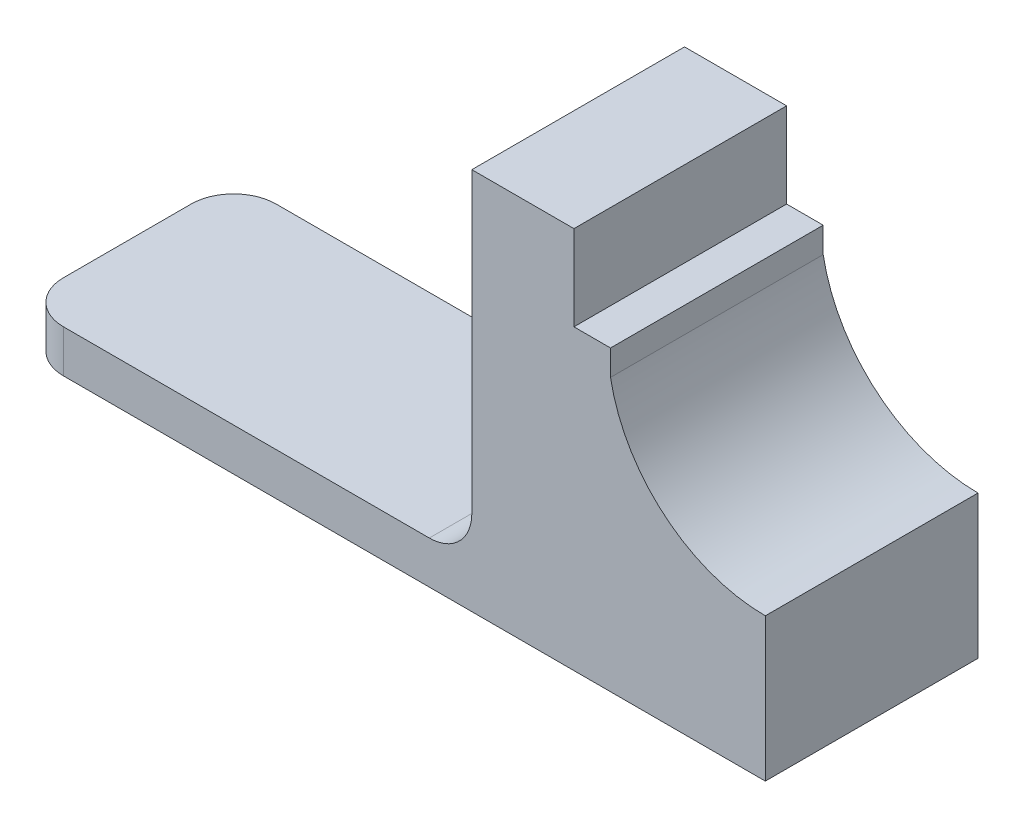
from build123d import *

# Parameters (mm, degrees)
BOSS_EXTRUDE1_DEPTH = 635
FILLET5_R           = 127
FILLET6_R           = 127


with BuildPart() as part:
    # Sketch3 → Boss-Extrude1 (new body)
    with BuildSketch(Plane.XY):
        with BuildLine():
            Line((-2079.212661728, -769.863228), (-860.012661728, -769.863228))
            ThreePointArc((-860.012661728, -769.863228), (-770.210100518, -732.665789211), (-733.012661728, -642.863228))
            Line((-733.012661728, -642.863228), (-733.012661728, 246.136772))
            Line((-733.012661728, 246.136772), (-428.150553924, 246.136772))
            Line((-428.150553924, 246.136772), (-428.150553924, -7.863228))
            Line((-428.150553924, -7.863228), (-326.612661728, -7.863228))
            Line((-326.612661728, -7.863228), (-318.929679791, -7.863228))
            Line((-318.929679791, -7.863228), (-318.929679791, -84.063228))
            ThreePointArc((-318.929679791, -84.063228), (-157.578570713, -360.389072068), (143.287338272, -469.33794683))
            Line((143.287338272, -469.33794683), (143.287338272, -896.863228))
            Line((143.287338272, -896.863228), (-2079.212661728, -896.863228))
            Line((-2079.212661728, -896.863228), (-2079.212661728, -769.863228))
        make_face()
    extrude(amount=BOSS_EXTRUDE1_DEPTH)

    # Fillet5
    fillet5_edges = [part.edges().sort_by_distance(p)[0] for p in [
        (-2079.212661728, -833.363228, 635),
    ]]
    fillet(fillet5_edges, radius=FILLET5_R)

    # Fillet6
    fillet6_edges = [part.edges().sort_by_distance(p)[0] for p in [
        (-2079.212661728, -833.363228, 0),
    ]]
    fillet(fillet6_edges, radius=FILLET6_R)


solid = part.part
